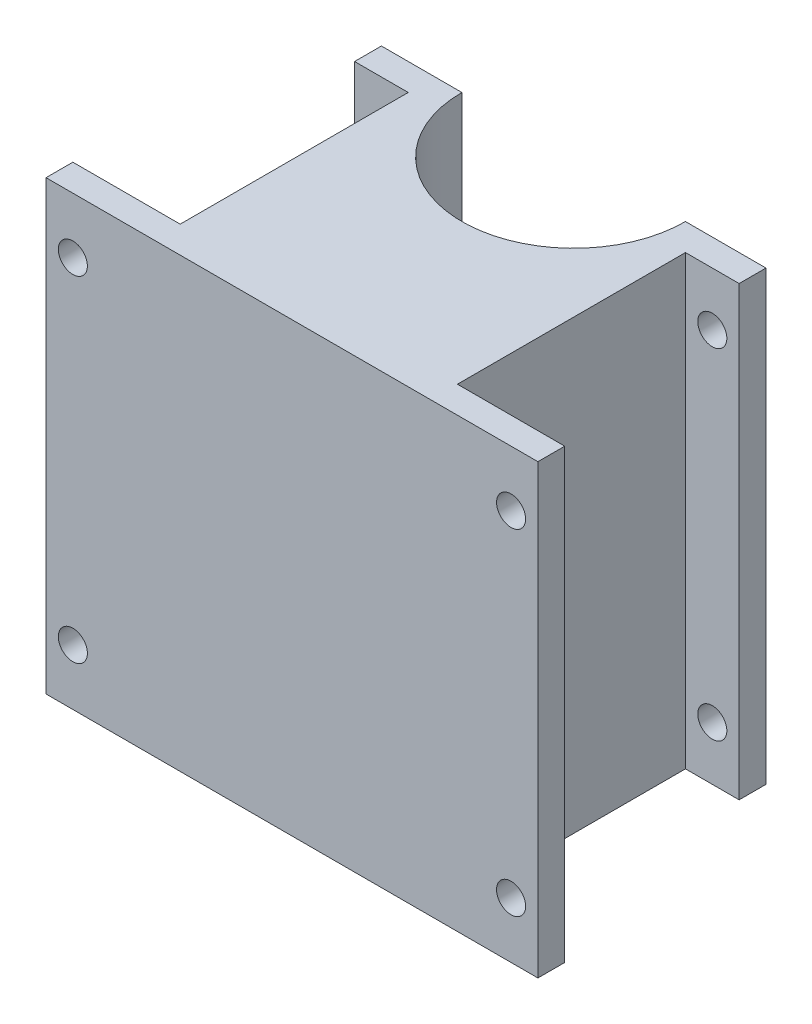
from build123d import *

# Parameters (mm, degrees)
BOSS_EXTRU_2_DEPTH      = 50
ESQUISSE2_R             = 1.625
ENL_V_MAT_EXTRU_2_DEPTH = 6
ESQUISSE4_R             = 1.625
ENL_V_MAT_EXTRU_3_DEPTH = 14
ESQUISSE3_R             = 1.625
ENL_V_MAT_EXTRU_4_DEPTH = 14


with BuildPart() as part:
    # Esquisse1 → Boss.-Extru.2 (new body)
    with BuildSketch(Plane(origin=(0, 0, 0), x_dir=(1, 0, 0), z_dir=(0, 1, 0))):
        with BuildLine():
            Line((-6, 28.5), (-6, 31.5))
            Line((-6, 31.5), (3, 31.5))
            ThreePointArc((3, 31.5), (15.5, 19), (28, 31.5))
            Line((28, 31.5), (37, 31.5))
            Line((37, 31.5), (37, 28.5))
            Line((37, 28.5), (31, 28.5))
            Line((31, 28.5), (31, 3))
            Line((31, 3), (43, 3))
            Line((43, 3), (43, 0))
            Line((43, 0), (-12, 0))
            Line((-12, 0), (-12, 3))
            Line((-12, 3), (0, 3))
            Line((0, 3), (0, 28.5))
            Line((0, 28.5), (-6, 28.5))
        make_face()
    extrude(amount=BOSS_EXTRU_2_DEPTH)

    # Esquisse2 → Enlèv. mat.-Extru.2 (cut)
    with BuildSketch(Plane(origin=(0, 0, -31.5), x_dir=(-1, 0, 0), z_dir=(0, 0, -1))):
        with Locations((3, 44)):
            Circle(ESQUISSE2_R)
        with Locations((3, 6)):
            Circle(ESQUISSE2_R)
        with Locations((-34, 44)):
            Circle(ESQUISSE2_R)
        with Locations((-34, 6)):
            Circle(ESQUISSE2_R)
    extrude(amount=-ENL_V_MAT_EXTRU_2_DEPTH, mode=Mode.SUBTRACT)

    # Esquisse4 → Enlèv. mat.-Extru.3 (cut)
    with BuildSketch(Plane(origin=(0, 0, -3), x_dir=(-1, 0, 0), z_dir=(0, 0, -1))):
        with Locations((9, 6.25)):
            Circle(ESQUISSE4_R)
        with Locations((9, 43.75)):
            Circle(ESQUISSE4_R)
    extrude(amount=-ENL_V_MAT_EXTRU_3_DEPTH, mode=Mode.SUBTRACT)

    # Esquisse3 → Enlèv. mat.-Extru.4 (cut)
    with BuildSketch(Plane(origin=(0, 0, -3), x_dir=(-1, 0, 0), z_dir=(0, 0, -1))):
        with Locations((-40, 6.25)):
            Circle(ESQUISSE3_R)
        with Locations((-40, 43.75)):
            Circle(ESQUISSE3_R)
    extrude(amount=-ENL_V_MAT_EXTRU_4_DEPTH, mode=Mode.SUBTRACT)


solid = part.part
